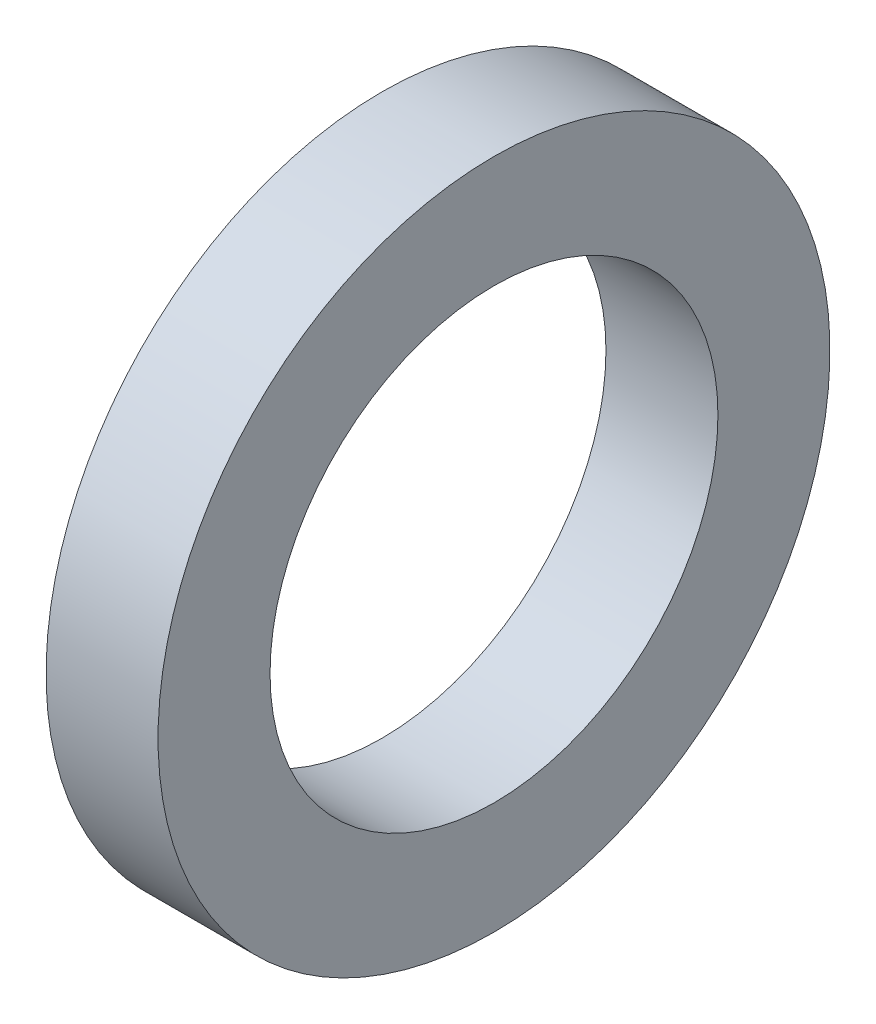
from build123d import *

# Parameters (mm, degrees)
SKETCH1_W = 2
SKETCH1_H = 6
SKETCH2_W = 2
SKETCH2_H = 4


with BuildPart() as part:
    # Sketch1 → Revolve1 (revolve)
    with BuildSketch(Plane.XY, mode=Mode.PRIVATE) as revolve1_sk:
        with Locations((1, -3)):
            Rectangle(SKETCH1_W, SKETCH1_H)
    revolve(revolve1_sk.sketch.rotate(Axis((0, 0, 0), (1, 0, 0)), 180), axis=Axis((0, 0, 0), (1, 0, 0)))

    # Sketch2 → Cut-Revolve1 (revolve, cut)
    with BuildSketch(Plane.XY, mode=Mode.PRIVATE) as cut_revolve1_sk:
        with Locations((1, -2)):
            Rectangle(SKETCH2_W, SKETCH2_H)
    revolve(cut_revolve1_sk.sketch.rotate(Axis((0, 0, 0), (1, 0, 0)), 180), axis=Axis((0, 0, 0), (1, 0, 0)), mode=Mode.SUBTRACT)


solid = part.part
